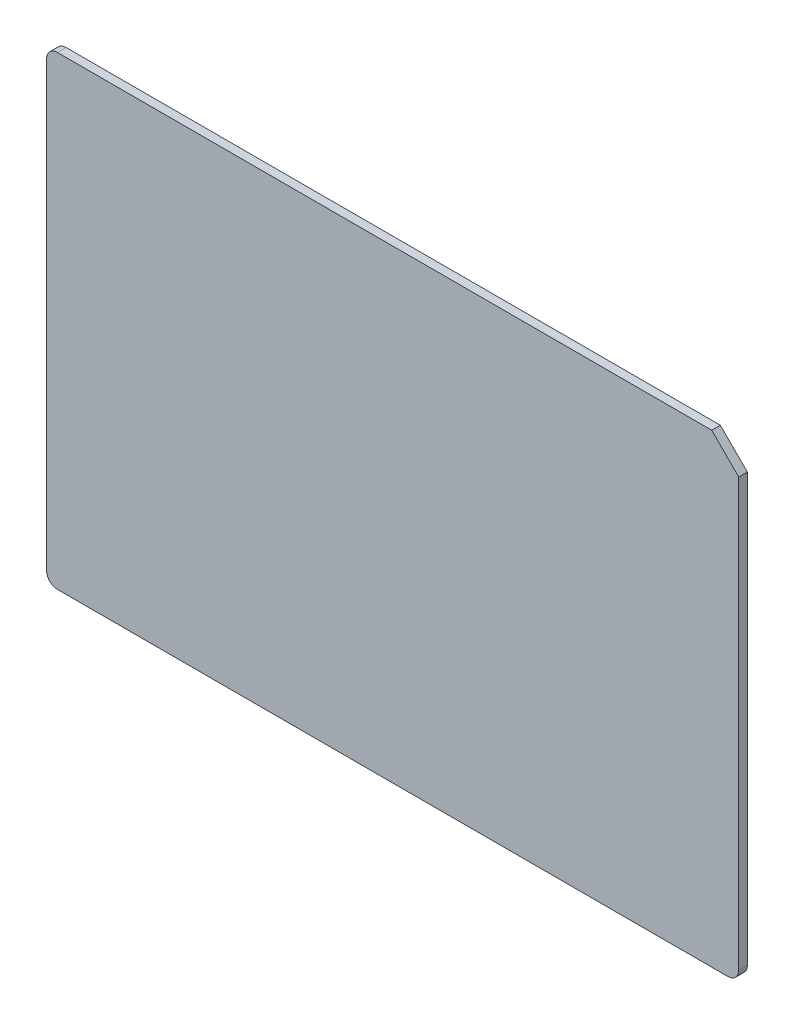
from build123d import *

# Parameters (mm, degrees)
BOSS_EXTRUDE1_DEPTH = 1.6


with BuildPart() as part:
    # Sketch1 → Boss-Extrude1 (new body)
    with BuildSketch(Plane.XY):
        with BuildLine():
            Line((-2.246334873, 79.89819124), (-2.246334873, -2.101808758))
            ThreePointArc((-2.246334873, -2.101808758), (-1.660548435, -3.516022321), (-0.246334873, -4.101808758))
            Line((-0.246334873, -4.101808758), (123.753665128, -4.101808758))
            ThreePointArc((123.753665128, -4.101808758), (125.16787869, -3.516022321), (125.753665128, -2.101808758))
            Line((125.753665128, -2.101808758), (125.753665128, 76.89819124))
            Line((125.753665128, 76.89819124), (120.753665128, 81.89819124))
            Line((120.753665128, 81.89819124), (-0.246334873, 81.89819124))
            ThreePointArc((-0.246334873, 81.89819124), (-1.660548435, 81.312404802), (-2.246334873, 79.89819124))
        make_face()
    extrude(amount=BOSS_EXTRUDE1_DEPTH)


solid = part.part
